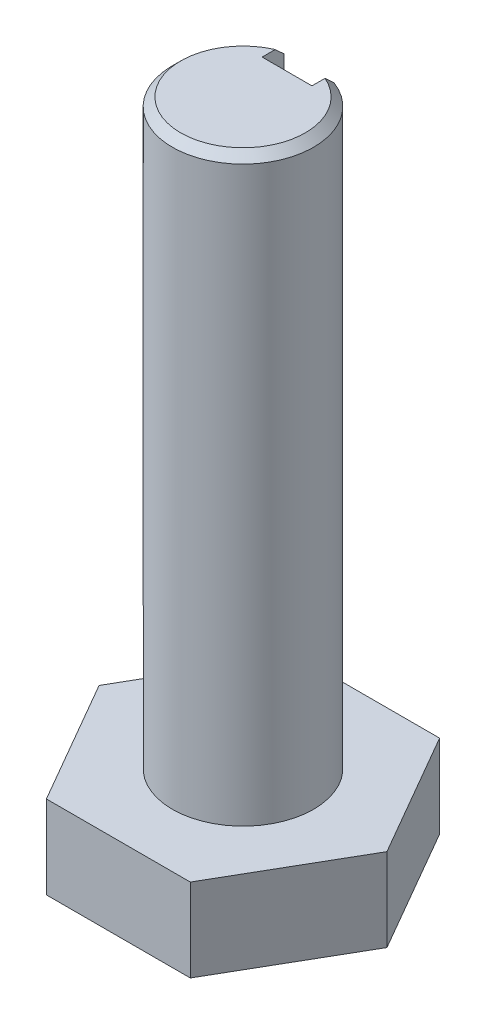
from build123d import *

# Parameters (mm, degrees)
BASE_HEXAGONAL_10MM_DEPTH = 10
SKETCH2_R                 = 8.5
EIXO_70MM_DEPTH           = 70
SKETCH3_W                 = 6
SKETCH3_H                 = 6.4
RASGO_DE_CHAVETA_DEPTH    = 40
RAIO_2MM_R                = 2
CHANFRO_1X45_SIZE         = 1


with BuildPart() as part:
    # Sketch1 → Base Hexagonal 10mm (new body)
    with BuildSketch(Plane(origin=(0, 0, 0), x_dir=(1, 0, 0), z_dir=(0, 1, 0))):
        Polygon((8.660254038, 15), (-8.660254038, 15), (-17.320508076, 0), (-8.660254038, -15), (8.660254038, -15), (17.320508076, 0), align=None)
    extrude(amount=BASE_HEXAGONAL_10MM_DEPTH)

    # Sketch2 → Eixo 70mm (add)
    with BuildSketch(Plane(origin=(0, 10, 0), x_dir=(1, 0, 0), z_dir=(0, 1, 0))):
        with Locations(Location((0, 0, 0), (0, 0, 270))):
            Circle(SKETCH2_R)
    extrude(amount=EIXO_70MM_DEPTH)

    # Sketch3 → Rasgo de Chaveta (cut)
    with BuildSketch(Plane(origin=(0, 80, 0), x_dir=(1, 0, 0), z_dir=(0, 1, 0))):
        with Locations((0, 8.5)):
            Rectangle(SKETCH3_W, SKETCH3_H)
    extrude(amount=-RASGO_DE_CHAVETA_DEPTH, mode=Mode.SUBTRACT)

    # Raio 2mm
    raio_2mm_edges = [part.edges().sort_by_distance(p)[0] for p in [
        (3, 40, -6.62649343),
        (-3, 40, -6.62649343),
    ]]
    fillet(raio_2mm_edges, radius=RAIO_2MM_R)

    # Chanfro 1x45°
    chanfro_1x45_edges = [part.edges().sort_by_distance(p)[0] for p in [
        (-8.362128566, 80, 1.524731401),
    ]]
    chamfer(chanfro_1x45_edges, length=CHANFRO_1X45_SIZE)


solid = part.part
